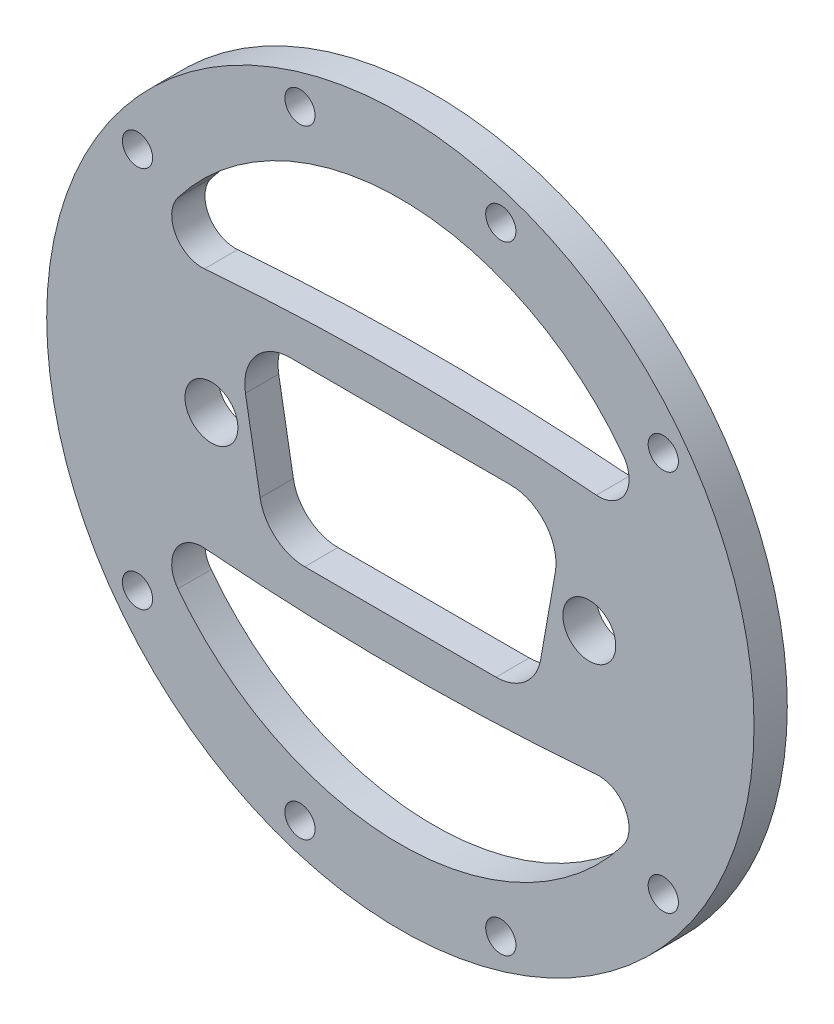
from build123d import *

# Parameters (mm, degrees)
SKIZZE1_R                       = 23.4
SKIZZE1_R_2                     = 1
LINEAR_AUSTRAGEN1_DEPTH         = 2.2
SKIZZE3_R                       = 1.75
SCHNITT_LINEAR_AUSTRAGEN3_DEPTH = 34.165644875


with BuildPart() as part:
    # Skizze1 → Linear austragen1 (new body)
    with BuildSketch(Plane.XY):
        Circle(SKIZZE1_R)
        with Locations((6.643865379, 20.4477151)):
            Circle(SKIZZE1_R_2, mode=Mode.SUBTRACT)
        with Locations((17.393865379, 12.637382924)):
            Circle(SKIZZE1_R_2, mode=Mode.SUBTRACT)
        with Locations((17.393865379, -12.637382924)):
            Circle(SKIZZE1_R_2, mode=Mode.SUBTRACT)
        with Locations((-6.643865379, 20.4477151)):
            Circle(SKIZZE1_R_2, mode=Mode.SUBTRACT)
        with Locations((6.643865379, -20.4477151)):
            Circle(SKIZZE1_R_2, mode=Mode.SUBTRACT)
        with Locations((-6.643865379, -20.4477151)):
            Circle(SKIZZE1_R_2, mode=Mode.SUBTRACT)
        with Locations((-17.393865379, -12.637382924)):
            Circle(SKIZZE1_R_2, mode=Mode.SUBTRACT)
        with Locations((-17.393865379, 12.637382924)):
            Circle(SKIZZE1_R_2, mode=Mode.SUBTRACT)
        with BuildLine():
            ThreePointArc((14.720859381, 11.20474449), (0, 18.5), (-14.720859381, 11.20474449))
            ThreePointArc((-14.720859381, 11.20474449), (-14.883940446, 9.033399462), (-12.967323579, 8))
            ThreePointArc((-12.967323579, 8), (0, 8.526339105), (12.967323579, 8))
            ThreePointArc((12.967323579, 8), (14.883940446, 9.033399462), (14.720859381, 11.20474449))
        make_face(mode=Mode.SUBTRACT)
        with BuildLine():
            ThreePointArc((-14.720859381, -11.20474449), (0, -18.5), (14.720859381, -11.20474449))
            ThreePointArc((14.720859381, -11.20474449), (14.883940446, -9.033399462), (12.967323579, -8))
            ThreePointArc((12.967323579, -8), (0, -8.526339105), (-12.967323579, -8))
            ThreePointArc((-12.967323579, -8), (-14.883940446, -9.033399462), (-14.720859381, -11.20474449))
        make_face(mode=Mode.SUBTRACT)
    extrude(amount=LINEAR_AUSTRAGEN1_DEPTH)

    # Skizze3 → Schnitt-Linear austragen3 (cut, through all)
    with BuildSketch(Plane.XY.offset(2.2)):
        with Locations((12.5, 0)):
            Circle(SKIZZE3_R)
        with Locations(Location((-12.5, 0, 0), (0, 0, 180))):
            Circle(SKIZZE3_R)
        with BuildLine():
            Line((-7.295576741, 5.75), (7.295576741, 5.75))
            ThreePointArc((7.295576741, 5.75), (9.59371007, 4.678362829), (10.25, 2.229055467))
            Line((10.25, 2.229055467), (9.280201606, -3.270944533))
            ThreePointArc((9.280201606, -3.270944533), (8.254141176, -5.048133329), (6.325778347, -5.75))
            Line((6.325778347, -5.75), (-6.325778347, -5.75))
            ThreePointArc((-6.325778347, -5.75), (-8.254141176, -5.048133329), (-9.280201606, -3.270944533))
            Line((-9.280201606, -3.270944533), (-10.25, 2.229055467))
            ThreePointArc((-10.25, 2.229055467), (-9.59371007, 4.678362829), (-7.295576741, 5.75))
        make_face()
    extrude(amount=-SCHNITT_LINEAR_AUSTRAGEN3_DEPTH, mode=Mode.SUBTRACT)


solid = part.part
